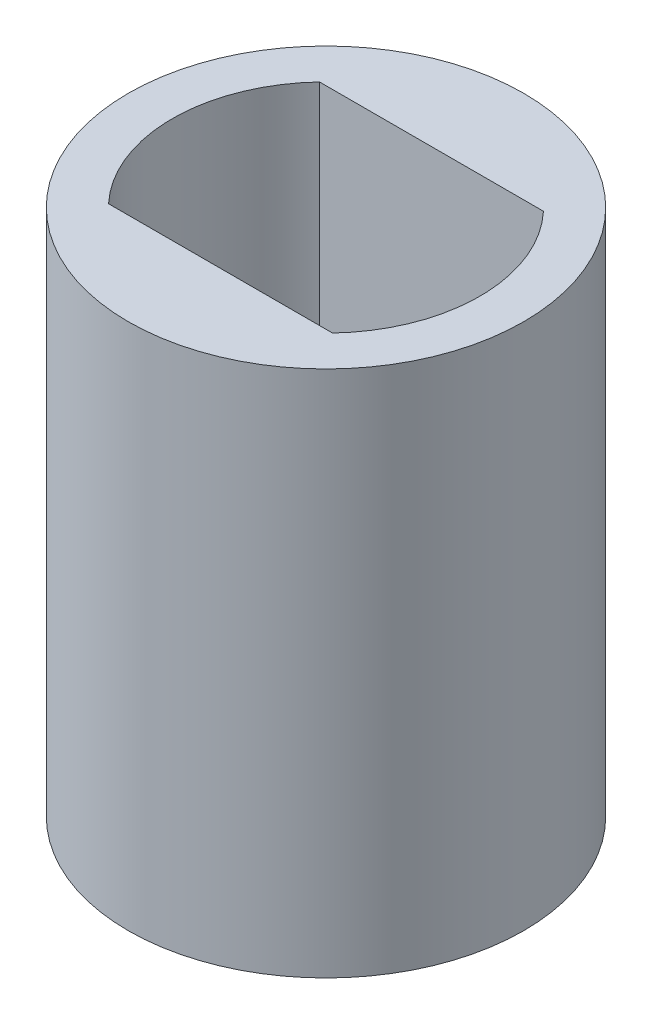
from build123d import *

# Parameters (mm, degrees)
EXTRUDE_START       = 3
SKETCH_1_R          = 4.5
EXTRUDE_1_DEPTH     = 12
CUT_EXTRUDE_3_DEPTH = 5
SKETCH_3_R          = 2.5
CUT_EXTRUDE_4_DEPTH = 7


with BuildPart() as part:
    # Эскиз1 → Вытянуть1 (new body)
    with BuildSketch(Plane(origin=(0, 0, 0), x_dir=(1, 0, 0), z_dir=(0, 1, 0)).offset(EXTRUDE_START)):
        with Locations(Location((0, 0, 0), (0, 0, 270))):
            Circle(SKETCH_1_R)
    extrude(amount=EXTRUDE_1_DEPTH)

    # Эскиз2 → Вытянуть3 (cut)
    with BuildSketch(Plane(origin=(0, 15, 0), x_dir=(1, 0, 0), z_dir=(0, 1, 0))):
        with BuildLine():
            Line((-2.547547841, 2.4), (2.547547841, 2.4))
            ThreePointArc((2.547547841, 2.4), (3.5, 0), (2.547547841, -2.4))
            Line((2.547547841, -2.4), (-2.547547841, -2.4))
            ThreePointArc((-2.547547841, -2.4), (-3.5, 0), (-2.547547841, 2.4))
        make_face()
    extrude(amount=-CUT_EXTRUDE_3_DEPTH, mode=Mode.SUBTRACT)

    # Эскиз3 → Вытянуть4 (cut)
    with BuildSketch(Plane.XZ.offset(-3)):
        with Locations(Location((0, 0, 0), (0, 0, 270))):
            Circle(SKETCH_3_R)
    extrude(amount=-CUT_EXTRUDE_4_DEPTH, mode=Mode.SUBTRACT)


solid = part.part
